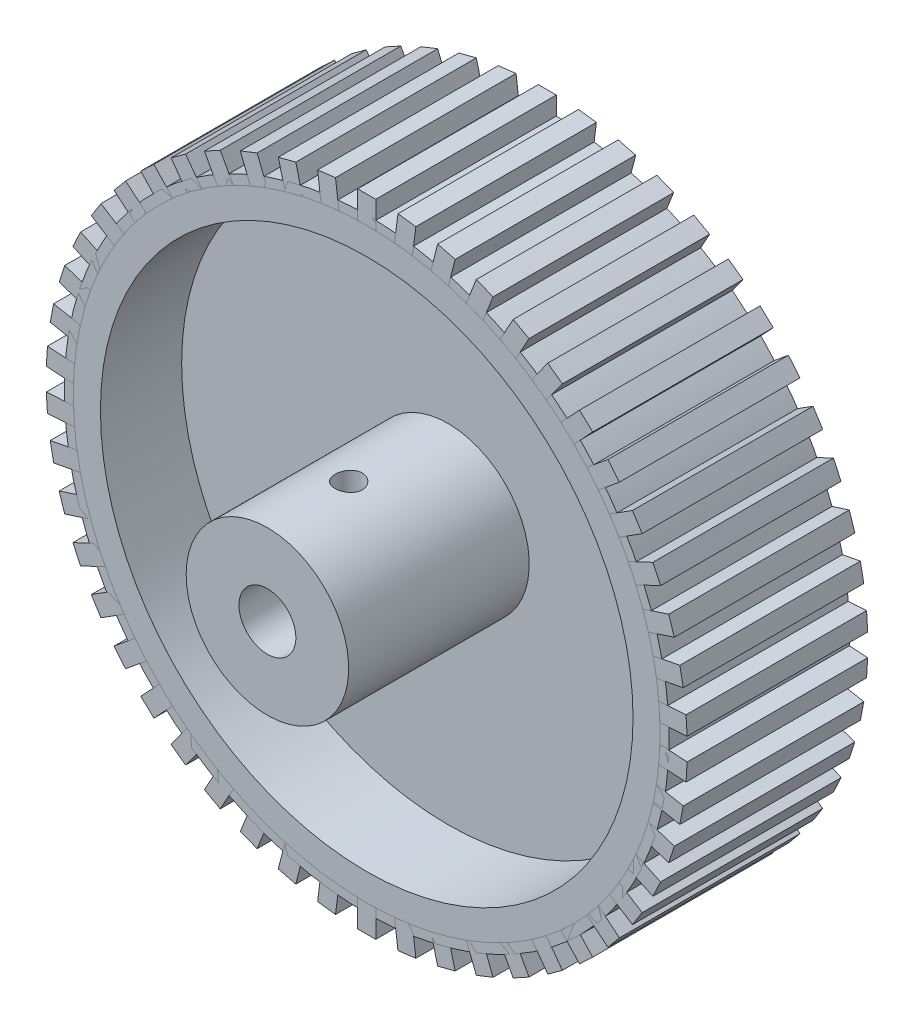
from build123d import *

# Parameters (mm, degrees)
SKETCH2_R              = 1.5
CUT_EXTRUDE1_DEPTH     = 10
SKETCH3_R              = 33.5
SKETCH3_R_2            = 32.5
BOSS_EXTRUDE1_DEPTH    = 20
BOSS_EXTRUDE2_DEPTH    = 20
SKETCH4_W              = 2
SKETCH4_H              = 3.015388258
BOSS_EXTRUDE2_2_DEPTH  = 20
BOSS_EXTRUDE2_3_DEPTH  = 20
BOSS_EXTRUDE2_4_DEPTH  = 20
BOSS_EXTRUDE2_5_DEPTH  = 20
BOSS_EXTRUDE2_6_DEPTH  = 20
BOSS_EXTRUDE2_7_DEPTH  = 20
BOSS_EXTRUDE2_8_DEPTH  = 20
BOSS_EXTRUDE2_9_DEPTH  = 20
BOSS_EXTRUDE2_10_DEPTH = 20
BOSS_EXTRUDE2_11_DEPTH = 20
BOSS_EXTRUDE2_12_DEPTH = 20
BOSS_EXTRUDE2_13_DEPTH = 20
BOSS_EXTRUDE2_14_DEPTH = 20
BOSS_EXTRUDE2_15_DEPTH = 20
BOSS_EXTRUDE2_16_DEPTH = 20
BOSS_EXTRUDE2_17_DEPTH = 20
BOSS_EXTRUDE2_18_DEPTH = 20
BOSS_EXTRUDE2_19_DEPTH = 20
BOSS_EXTRUDE2_20_DEPTH = 20
BOSS_EXTRUDE2_21_DEPTH = 20
BOSS_EXTRUDE2_22_DEPTH = 20
BOSS_EXTRUDE2_23_DEPTH = 20
BOSS_EXTRUDE2_24_DEPTH = 20
BOSS_EXTRUDE2_25_DEPTH = 20
BOSS_EXTRUDE2_26_DEPTH = 20
BOSS_EXTRUDE2_27_DEPTH = 20
BOSS_EXTRUDE2_28_DEPTH = 20
BOSS_EXTRUDE2_29_DEPTH = 20
BOSS_EXTRUDE2_30_DEPTH = 20
BOSS_EXTRUDE2_31_DEPTH = 20
BOSS_EXTRUDE2_32_DEPTH = 20
BOSS_EXTRUDE2_33_DEPTH = 20
BOSS_EXTRUDE2_34_DEPTH = 20
BOSS_EXTRUDE2_35_DEPTH = 20
BOSS_EXTRUDE2_36_DEPTH = 20
BOSS_EXTRUDE2_37_DEPTH = 20
BOSS_EXTRUDE2_38_DEPTH = 20
BOSS_EXTRUDE2_39_DEPTH = 20
BOSS_EXTRUDE2_40_DEPTH = 20
BOSS_EXTRUDE2_41_DEPTH = 20
BOSS_EXTRUDE2_42_DEPTH = 20
BOSS_EXTRUDE2_43_DEPTH = 20
BOSS_EXTRUDE2_44_DEPTH = 20
BOSS_EXTRUDE2_45_DEPTH = 20
BOSS_EXTRUDE2_46_DEPTH = 20
BOSS_EXTRUDE2_47_DEPTH = 20
BOSS_EXTRUDE2_48_DEPTH = 20
BOSS_EXTRUDE2_49_DEPTH = 20
BOSS_EXTRUDE2_50_DEPTH = 20


with BuildPart() as part:
    # Sketch1 → Revolve1 (revolve)
    with BuildSketch(Plane(origin=(0, 0, 0), x_dir=(0, 0, -1), z_dir=(1, 0, 0)), mode=Mode.PRIVATE) as revolve1_sk:
        Polygon((0, 3.15), (-22, 3.15), (-22, 9), (-2, 9), (-2, 29.5), (-11, 29.5), (-11, 32.5), (9, 32.5), (9, 29.5), (0, 29.5), align=None)
    revolve(revolve1_sk.sketch.rotate(Axis((0, 0, 0), (0, 0, 1)), 90), axis=Axis((0, 0, 0), (0, 0, 1)))

    # Sketch2 → Cut-Extrude1 (cut)
    with BuildSketch(Plane(origin=(0, 0, 0), x_dir=(1, 0, 0), z_dir=(0, 1, 0))):
        with Locations(Location((0, -13, 0), (0, 0, 90))):
            Circle(SKETCH2_R)
    extrude(amount=CUT_EXTRUDE1_DEPTH, mode=Mode.SUBTRACT)


with BuildPart() as body_2:
    # Sketch3 → Boss-Extrude1 (new body)
    with BuildSketch(Plane.XY.offset(11)):
        Circle(SKETCH3_R)
        Circle(SKETCH3_R_2, mode=Mode.SUBTRACT)
    extrude(amount=-BOSS_EXTRUDE1_DEPTH)


with BuildPart() as body_3:
    # Sketch4 → Boss-Extrude2 (new body)
    with BuildSketch(Plane(origin=(0, 0, -9), x_dir=(-1, 0, 0), z_dir=(0, 0, -1))):
        Polygon((3.45721509, 35.34540513), (3.079286729, 32.353794109), (5.063516132, 32.103127642), (5.441444493, 35.094738663), align=None)
    extrude(amount=-BOSS_EXTRUDE2_DEPTH)


with BuildPart() as body_4:
    # Sketch4 → Boss-Extrude2 2 (new body)
    with BuildSketch(Plane(origin=(0, 0, -9), x_dir=(-1, 0, 0), z_dir=(0, 0, -1))):
        with Locations((0, 33.992305871)):
            Rectangle(SKETCH4_W, SKETCH4_H)
    extrude(amount=-BOSS_EXTRUDE2_2_DEPTH)


with BuildPart() as body_5:
    # Sketch4 → Boss-Extrude2 3 (new body)
    with BuildSketch(Plane(origin=(0, 0, -9), x_dir=(-1, 0, 0), z_dir=(0, 0, -1))):
        Polygon((7.859907833, 34.633392107), (7.110011267, 31.712737816), (9.04717759, 31.215358042), (9.797074155, 34.136012333), align=None)
    extrude(amount=-BOSS_EXTRUDE2_3_DEPTH)


with BuildPart() as body_6:
    # Sketch4 → Boss-Extrude2 4 (new body)
    with BuildSketch(Plane(origin=(0, 0, -9), x_dir=(-1, 0, 0), z_dir=(0, 0, -1))):
        Polygon((12.138645134, 33.375189802), (11.028606681, 30.571552703), (12.888159652, 29.835303598), (13.998198106, 32.638940696), align=None)
    extrude(amount=-BOSS_EXTRUDE2_4_DEPTH)


with BuildPart() as body_7:
    # Sketch4 → Boss-Extrude2 5 (new body)
    with BuildSketch(Plane(origin=(0, 0, -9), x_dir=(-1, 0, 0), z_dir=(0, 0, -1))):
        Polygon((16.225948751, 31.590640816), (14.773274378, 28.948235942), (16.525887738, 27.984728594), (17.978562111, 30.627133467), align=None)
    extrude(amount=-BOSS_EXTRUDE2_5_DEPTH)


with BuildPart() as body_8:
    # Sketch4 → Boss-Extrude2 6 (new body)
    with BuildSketch(Plane(origin=(0, 0, -9), x_dir=(-1, 0, 0), z_dir=(0, 0, -1))):
        Polygon((20.057359462, 29.307888553), (18.284958714, 26.868388207), (19.902992703, 25.692817702), (21.675393451, 28.132318048), align=None)
    extrude(amount=-BOSS_EXTRUDE2_6_DEPTH)


with BuildPart() as body_9:
    # Sketch4 → Boss-Extrude2 7 (new body)
    with BuildSketch(Plane(origin=(0, 0, -9), x_dir=(-1, 0, 0), z_dir=(0, 0, -1))):
        Polygon((23.572453633, 26.562933379), (21.508278327, 24.364809939), (22.966215582, 22.995715728), (25.030390888, 25.193839168), align=None)
    extrude(amount=-BOSS_EXTRUDE2_7_DEPTH)


with BuildPart() as body_10:
    # Sketch4 → Boss-Extrude2 8 (new body)
    with BuildSketch(Plane(origin=(0, 0, -9), x_dir=(-1, 0, 0), z_dir=(0, 0, -1))):
        Polygon((26.715796129, 23.399064879), (24.392399544, 21.476984065), (25.667247523, 19.935957579), (27.990644108, 21.858038393), align=None)
    extrude(amount=-BOSS_EXTRUDE2_8_DEPTH)


with BuildPart() as body_11:
    # Sketch4 → Boss-Extrude2 9 (new body)
    with BuildSketch(Plane(origin=(0, 0, -9), x_dir=(-1, 0, 0), z_dir=(0, 0, -1))):
        Polygon((29.43781456, 19.866179147), (26.891838048, 18.250453321), (27.963491637, 16.56179747), (30.50946815, 18.177523296), align=None)
    extrude(amount=-BOSS_EXTRUDE2_9_DEPTH)


with BuildPart() as body_12:
    # Sketch4 → Boss-Extrude2 10 (new body)
    with BuildSketch(Plane(origin=(0, 0, -9), x_dir=(-1, 0, 0), z_dir=(0, 0, -1))):
        Polygon((31.695581071, 16.019991903), (28.967176201, 14.736102027), (29.818734784, 12.926447922), (32.547139654, 14.210337798), align=None)
    extrude(amount=-BOSS_EXTRUDE2_10_DEPTH)


with BuildPart() as body_13:
    # Sketch4 → Boss-Extrude2 11 (new body)
    with BuildSketch(Plane(origin=(0, 0, -9), x_dir=(-1, 0, 0), z_dir=(0, 0, -1))):
        Polygon((33.453489334, 11.921159817), (30.585684682, 10.9893536), (31.203718671, 9.087240568), (34.071523323, 10.019046784), align=None)
    extrude(amount=-BOSS_EXTRUDE2_11_DEPTH)


with BuildPart() as body_14:
    # Sketch4 → Boss-Extrude2 12 (new body)
    with BuildSketch(Plane(origin=(0, 0, -9), x_dir=(-1, 0, 0), z_dir=(0, 0, -1))):
        Polygon((34.683816086, 7.634323919), (31.721838644, 7.069296503), (32.096601273, 5.104722001), (35.058578715, 5.669749417), align=None)
    extrude(amount=-BOSS_EXTRUDE2_12_DEPTH)


with BuildPart() as body_15:
    # Sketch4 → Boss-Extrude2 13 (new body)
    with BuildSketch(Plane(origin=(0, 0, -9), x_dir=(-1, 0, 0), z_dir=(0, 0, -1))):
        Polygon((35.36715834, 3.227090172), (32.357720261, 3.037752376), (32.4833013, 1.04169892), (35.492739379, 1.231036715), align=None)
    extrude(amount=-BOSS_EXTRUDE2_13_DEPTH)


with BuildPart() as body_16:
    # Sketch4 → Boss-Extrude2 14 (new body)
    with BuildSketch(Plane(origin=(0, 0, -9), x_dir=(-1, 0, 0), z_dir=(0, 0, -1))):
        Polygon((35.492739379, -1.231036715), (32.4833013, -1.04169892), (32.357720261, -3.037752376), (35.36715834, -3.227090172), align=None)
    extrude(amount=-BOSS_EXTRUDE2_14_DEPTH)


with BuildPart() as body_17:
    # Sketch4 → Boss-Extrude2 15 (new body)
    with BuildSketch(Plane(origin=(0, 0, -9), x_dir=(-1, 0, 0), z_dir=(0, 0, -1))):
        Polygon((35.058578715, -5.669749417), (32.096601273, -5.104722001), (31.721838644, -7.069296503), (34.683816086, -7.634323919), align=None)
    extrude(amount=-BOSS_EXTRUDE2_15_DEPTH)


with BuildPart() as body_18:
    # Sketch4 → Boss-Extrude2 16 (new body)
    with BuildSketch(Plane(origin=(0, 0, -9), x_dir=(-1, 0, 0), z_dir=(0, 0, -1))):
        Polygon((34.071523323, -10.019046784), (31.203718671, -9.087240568), (30.585684682, -10.9893536), (33.453489334, -11.921159817), align=None)
    extrude(amount=-BOSS_EXTRUDE2_16_DEPTH)


with BuildPart() as body_19:
    # Sketch4 → Boss-Extrude2 17 (new body)
    with BuildSketch(Plane(origin=(0, 0, -9), x_dir=(-1, 0, 0), z_dir=(0, 0, -1))):
        Polygon((32.547139654, -14.210337798), (29.818734784, -12.926447922), (28.967176201, -14.736102027), (31.695581071, -16.019991903), align=None)
    extrude(amount=-BOSS_EXTRUDE2_17_DEPTH)


with BuildPart() as body_20:
    # Sketch4 → Boss-Extrude2 18 (new body)
    with BuildSketch(Plane(origin=(0, 0, -9), x_dir=(-1, 0, 0), z_dir=(0, 0, -1))):
        Polygon((30.50946815, -18.177523296), (27.963491637, -16.56179747), (26.891838048, -18.250453321), (29.43781456, -19.866179147), align=None)
    extrude(amount=-BOSS_EXTRUDE2_18_DEPTH)


with BuildPart() as body_21:
    # Sketch4 → Boss-Extrude2 19 (new body)
    with BuildSketch(Plane(origin=(0, 0, -9), x_dir=(-1, 0, 0), z_dir=(0, 0, -1))):
        Polygon((27.990644108, -21.858038393), (25.667247523, -19.935957579), (24.392399544, -21.476984065), (26.715796129, -23.399064879), align=None)
    extrude(amount=-BOSS_EXTRUDE2_19_DEPTH)


with BuildPart() as body_22:
    # Sketch4 → Boss-Extrude2 20 (new body)
    with BuildSketch(Plane(origin=(0, 0, -9), x_dir=(-1, 0, 0), z_dir=(0, 0, -1))):
        Polygon((25.030390888, -25.193839168), (22.966215582, -22.995715728), (21.508278327, -24.364809939), (23.572453633, -26.562933379), align=None)
    extrude(amount=-BOSS_EXTRUDE2_20_DEPTH)


with BuildPart() as body_23:
    # Sketch4 → Boss-Extrude2 21 (new body)
    with BuildSketch(Plane(origin=(0, 0, -9), x_dir=(-1, 0, 0), z_dir=(0, 0, -1))):
        Polygon((21.675393451, -28.132318048), (19.902992703, -25.692817702), (18.284958714, -26.868388207), (20.057359462, -29.307888553), align=None)
    extrude(amount=-BOSS_EXTRUDE2_21_DEPTH)


with BuildPart() as body_24:
    # Sketch4 → Boss-Extrude2 22 (new body)
    with BuildSketch(Plane(origin=(0, 0, -9), x_dir=(-1, 0, 0), z_dir=(0, 0, -1))):
        Polygon((17.978562111, -30.627133467), (16.525887738, -27.984728594), (14.773274378, -28.948235942), (16.225948751, -31.590640816), align=None)
    extrude(amount=-BOSS_EXTRUDE2_22_DEPTH)


with BuildPart() as body_25:
    # Sketch4 → Boss-Extrude2 23 (new body)
    with BuildSketch(Plane(origin=(0, 0, -9), x_dir=(-1, 0, 0), z_dir=(0, 0, -1))):
        Polygon((13.998198106, -32.638940696), (12.888159652, -29.835303598), (11.028606681, -30.571552703), (12.138645134, -33.375189802), align=None)
    extrude(amount=-BOSS_EXTRUDE2_23_DEPTH)


with BuildPart() as body_26:
    # Sketch4 → Boss-Extrude2 24 (new body)
    with BuildSketch(Plane(origin=(0, 0, -9), x_dir=(-1, 0, 0), z_dir=(0, 0, -1))):
        Polygon((9.797074155, -34.136012333), (9.04717759, -31.215358042), (7.110011267, -31.712737816), (7.859907833, -34.633392107), align=None)
    extrude(amount=-BOSS_EXTRUDE2_24_DEPTH)


with BuildPart() as body_27:
    # Sketch4 → Boss-Extrude2 25 (new body)
    with BuildSketch(Plane(origin=(0, 0, -9), x_dir=(-1, 0, 0), z_dir=(0, 0, -1))):
        Polygon((5.441444493, -35.094738663), (5.063516132, -32.103127642), (3.079286729, -32.353794109), (3.45721509, -35.34540513), align=None)
    extrude(amount=-BOSS_EXTRUDE2_25_DEPTH)


with BuildPart() as body_28:
    # Sketch4 → Boss-Extrude2 26 (new body)
    with BuildSketch(Plane(origin=(0, 0, -9), x_dir=(-1, 0, 0), z_dir=(0, 0, -1))):
        with Locations((0, -33.992305871)):
            Rectangle(SKETCH4_W, SKETCH4_H)
    extrude(amount=-BOSS_EXTRUDE2_26_DEPTH)


with BuildPart() as body_29:
    # Sketch4 → Boss-Extrude2 27 (new body)
    with BuildSketch(Plane(origin=(0, 0, -9), x_dir=(-1, 0, 0), z_dir=(0, 0, -1))):
        Polygon((-3.45721509, -35.34540513), (-3.079286729, -32.353794109), (-5.063516132, -32.103127642), (-5.441444493, -35.094738663), align=None)
    extrude(amount=-BOSS_EXTRUDE2_27_DEPTH)


with BuildPart() as body_30:
    # Sketch4 → Boss-Extrude2 28 (new body)
    with BuildSketch(Plane(origin=(0, 0, -9), x_dir=(-1, 0, 0), z_dir=(0, 0, -1))):
        Polygon((-7.859907833, -34.633392107), (-7.110011267, -31.712737816), (-9.04717759, -31.215358042), (-9.797074155, -34.136012333), align=None)
    extrude(amount=-BOSS_EXTRUDE2_28_DEPTH)


with BuildPart() as body_31:
    # Sketch4 → Boss-Extrude2 29 (new body)
    with BuildSketch(Plane(origin=(0, 0, -9), x_dir=(-1, 0, 0), z_dir=(0, 0, -1))):
        Polygon((-12.138645134, -33.375189802), (-11.028606681, -30.571552703), (-12.888159652, -29.835303598), (-13.998198106, -32.638940696), align=None)
    extrude(amount=-BOSS_EXTRUDE2_29_DEPTH)


with BuildPart() as body_32:
    # Sketch4 → Boss-Extrude2 30 (new body)
    with BuildSketch(Plane(origin=(0, 0, -9), x_dir=(-1, 0, 0), z_dir=(0, 0, -1))):
        Polygon((-16.225948751, -31.590640816), (-14.773274378, -28.948235942), (-16.525887738, -27.984728594), (-17.978562111, -30.627133467), align=None)
    extrude(amount=-BOSS_EXTRUDE2_30_DEPTH)


with BuildPart() as body_33:
    # Sketch4 → Boss-Extrude2 31 (new body)
    with BuildSketch(Plane(origin=(0, 0, -9), x_dir=(-1, 0, 0), z_dir=(0, 0, -1))):
        Polygon((-20.057359462, -29.307888553), (-18.284958714, -26.868388207), (-19.902992703, -25.692817702), (-21.675393451, -28.132318048), align=None)
    extrude(amount=-BOSS_EXTRUDE2_31_DEPTH)


with BuildPart() as body_34:
    # Sketch4 → Boss-Extrude2 32 (new body)
    with BuildSketch(Plane(origin=(0, 0, -9), x_dir=(-1, 0, 0), z_dir=(0, 0, -1))):
        Polygon((-23.572453633, -26.562933379), (-21.508278327, -24.364809939), (-22.966215582, -22.995715728), (-25.030390888, -25.193839168), align=None)
    extrude(amount=-BOSS_EXTRUDE2_32_DEPTH)


with BuildPart() as body_35:
    # Sketch4 → Boss-Extrude2 33 (new body)
    with BuildSketch(Plane(origin=(0, 0, -9), x_dir=(-1, 0, 0), z_dir=(0, 0, -1))):
        Polygon((-26.715796129, -23.399064879), (-24.392399544, -21.476984065), (-25.667247523, -19.935957579), (-27.990644108, -21.858038393), align=None)
    extrude(amount=-BOSS_EXTRUDE2_33_DEPTH)


with BuildPart() as body_36:
    # Sketch4 → Boss-Extrude2 34 (new body)
    with BuildSketch(Plane(origin=(0, 0, -9), x_dir=(-1, 0, 0), z_dir=(0, 0, -1))):
        Polygon((-29.43781456, -19.866179147), (-26.891838048, -18.250453321), (-27.963491637, -16.56179747), (-30.50946815, -18.177523296), align=None)
    extrude(amount=-BOSS_EXTRUDE2_34_DEPTH)


with BuildPart() as body_37:
    # Sketch4 → Boss-Extrude2 35 (new body)
    with BuildSketch(Plane(origin=(0, 0, -9), x_dir=(-1, 0, 0), z_dir=(0, 0, -1))):
        Polygon((-31.695581071, -16.019991903), (-28.967176201, -14.736102027), (-29.818734784, -12.926447922), (-32.547139654, -14.210337798), align=None)
    extrude(amount=-BOSS_EXTRUDE2_35_DEPTH)


with BuildPart() as body_38:
    # Sketch4 → Boss-Extrude2 36 (new body)
    with BuildSketch(Plane(origin=(0, 0, -9), x_dir=(-1, 0, 0), z_dir=(0, 0, -1))):
        Polygon((-33.453489334, -11.921159817), (-30.585684682, -10.9893536), (-31.203718671, -9.087240568), (-34.071523323, -10.019046784), align=None)
    extrude(amount=-BOSS_EXTRUDE2_36_DEPTH)


with BuildPart() as body_39:
    # Sketch4 → Boss-Extrude2 37 (new body)
    with BuildSketch(Plane(origin=(0, 0, -9), x_dir=(-1, 0, 0), z_dir=(0, 0, -1))):
        Polygon((-34.683816086, -7.634323919), (-31.721838644, -7.069296503), (-32.096601273, -5.104722001), (-35.058578715, -5.669749417), align=None)
    extrude(amount=-BOSS_EXTRUDE2_37_DEPTH)


with BuildPart() as body_40:
    # Sketch4 → Boss-Extrude2 38 (new body)
    with BuildSketch(Plane(origin=(0, 0, -9), x_dir=(-1, 0, 0), z_dir=(0, 0, -1))):
        Polygon((-35.36715834, -3.227090172), (-32.357720261, -3.037752376), (-32.4833013, -1.04169892), (-35.492739379, -1.231036715), align=None)
    extrude(amount=-BOSS_EXTRUDE2_38_DEPTH)


with BuildPart() as body_41:
    # Sketch4 → Boss-Extrude2 39 (new body)
    with BuildSketch(Plane(origin=(0, 0, -9), x_dir=(-1, 0, 0), z_dir=(0, 0, -1))):
        Polygon((-35.492739379, 1.231036715), (-32.4833013, 1.04169892), (-32.357720261, 3.037752376), (-35.36715834, 3.227090172), align=None)
    extrude(amount=-BOSS_EXTRUDE2_39_DEPTH)


with BuildPart() as body_42:
    # Sketch4 → Boss-Extrude2 40 (new body)
    with BuildSketch(Plane(origin=(0, 0, -9), x_dir=(-1, 0, 0), z_dir=(0, 0, -1))):
        Polygon((-35.058578715, 5.669749417), (-32.096601273, 5.104722001), (-31.721838644, 7.069296503), (-34.683816086, 7.634323919), align=None)
    extrude(amount=-BOSS_EXTRUDE2_40_DEPTH)


with BuildPart() as body_43:
    # Sketch4 → Boss-Extrude2 41 (new body)
    with BuildSketch(Plane(origin=(0, 0, -9), x_dir=(-1, 0, 0), z_dir=(0, 0, -1))):
        Polygon((-34.071523323, 10.019046784), (-31.203718671, 9.087240568), (-30.585684682, 10.9893536), (-33.453489334, 11.921159817), align=None)
    extrude(amount=-BOSS_EXTRUDE2_41_DEPTH)


with BuildPart() as body_44:
    # Sketch4 → Boss-Extrude2 42 (new body)
    with BuildSketch(Plane(origin=(0, 0, -9), x_dir=(-1, 0, 0), z_dir=(0, 0, -1))):
        Polygon((-32.547139654, 14.210337798), (-29.818734784, 12.926447922), (-28.967176201, 14.736102027), (-31.695581071, 16.019991903), align=None)
    extrude(amount=-BOSS_EXTRUDE2_42_DEPTH)


with BuildPart() as body_45:
    # Sketch4 → Boss-Extrude2 43 (new body)
    with BuildSketch(Plane(origin=(0, 0, -9), x_dir=(-1, 0, 0), z_dir=(0, 0, -1))):
        Polygon((-30.50946815, 18.177523296), (-27.963491637, 16.56179747), (-26.891838048, 18.250453321), (-29.43781456, 19.866179147), align=None)
    extrude(amount=-BOSS_EXTRUDE2_43_DEPTH)


with BuildPart() as body_46:
    # Sketch4 → Boss-Extrude2 44 (new body)
    with BuildSketch(Plane(origin=(0, 0, -9), x_dir=(-1, 0, 0), z_dir=(0, 0, -1))):
        Polygon((-27.990644108, 21.858038393), (-25.667247523, 19.935957579), (-24.392399544, 21.476984065), (-26.715796129, 23.399064879), align=None)
    extrude(amount=-BOSS_EXTRUDE2_44_DEPTH)


with BuildPart() as body_47:
    # Sketch4 → Boss-Extrude2 45 (new body)
    with BuildSketch(Plane(origin=(0, 0, -9), x_dir=(-1, 0, 0), z_dir=(0, 0, -1))):
        Polygon((-25.030390888, 25.193839168), (-22.966215582, 22.995715728), (-21.508278327, 24.364809939), (-23.572453633, 26.562933379), align=None)
    extrude(amount=-BOSS_EXTRUDE2_45_DEPTH)


with BuildPart() as body_48:
    # Sketch4 → Boss-Extrude2 46 (new body)
    with BuildSketch(Plane(origin=(0, 0, -9), x_dir=(-1, 0, 0), z_dir=(0, 0, -1))):
        Polygon((-21.675393451, 28.132318048), (-19.902992703, 25.692817702), (-18.284958714, 26.868388207), (-20.057359462, 29.307888553), align=None)
    extrude(amount=-BOSS_EXTRUDE2_46_DEPTH)


with BuildPart() as body_49:
    # Sketch4 → Boss-Extrude2 47 (new body)
    with BuildSketch(Plane(origin=(0, 0, -9), x_dir=(-1, 0, 0), z_dir=(0, 0, -1))):
        Polygon((-17.978562111, 30.627133467), (-16.525887738, 27.984728594), (-14.773274378, 28.948235942), (-16.225948751, 31.590640816), align=None)
    extrude(amount=-BOSS_EXTRUDE2_47_DEPTH)


with BuildPart() as body_50:
    # Sketch4 → Boss-Extrude2 48 (new body)
    with BuildSketch(Plane(origin=(0, 0, -9), x_dir=(-1, 0, 0), z_dir=(0, 0, -1))):
        Polygon((-13.998198106, 32.638940696), (-12.888159652, 29.835303598), (-11.028606681, 30.571552703), (-12.138645134, 33.375189802), align=None)
    extrude(amount=-BOSS_EXTRUDE2_48_DEPTH)


with BuildPart() as body_51:
    # Sketch4 → Boss-Extrude2 49 (new body)
    with BuildSketch(Plane(origin=(0, 0, -9), x_dir=(-1, 0, 0), z_dir=(0, 0, -1))):
        Polygon((-9.797074155, 34.136012333), (-9.04717759, 31.215358042), (-7.110011267, 31.712737816), (-7.859907833, 34.633392107), align=None)
    extrude(amount=-BOSS_EXTRUDE2_49_DEPTH)


with BuildPart() as body_52:
    # Sketch4 → Boss-Extrude2 50 (new body)
    with BuildSketch(Plane(origin=(0, 0, -9), x_dir=(-1, 0, 0), z_dir=(0, 0, -1))):
        Polygon((-5.441444493, 35.094738663), (-5.063516132, 32.103127642), (-3.079286729, 32.353794109), (-3.45721509, 35.34540513), align=None)
    extrude(amount=-BOSS_EXTRUDE2_50_DEPTH)


solid = Compound([part.part, body_2.part, body_3.part, body_4.part, body_5.part, body_6.part, body_7.part, body_8.part, body_9.part, body_10.part, body_11.part, body_12.part, body_13.part, body_14.part, body_15.part, body_16.part, body_17.part, body_18.part, body_19.part, body_20.part, body_21.part, body_22.part, body_23.part, body_24.part, body_25.part, body_26.part, body_27.part, body_28.part, body_29.part, body_30.part, body_31.part, body_32.part, body_33.part, body_34.part, body_35.part, body_36.part, body_37.part, body_38.part, body_39.part, body_40.part, body_41.part, body_42.part, body_43.part, body_44.part, body_45.part, body_46.part, body_47.part, body_48.part, body_49.part, body_50.part, body_51.part, body_52.part])
